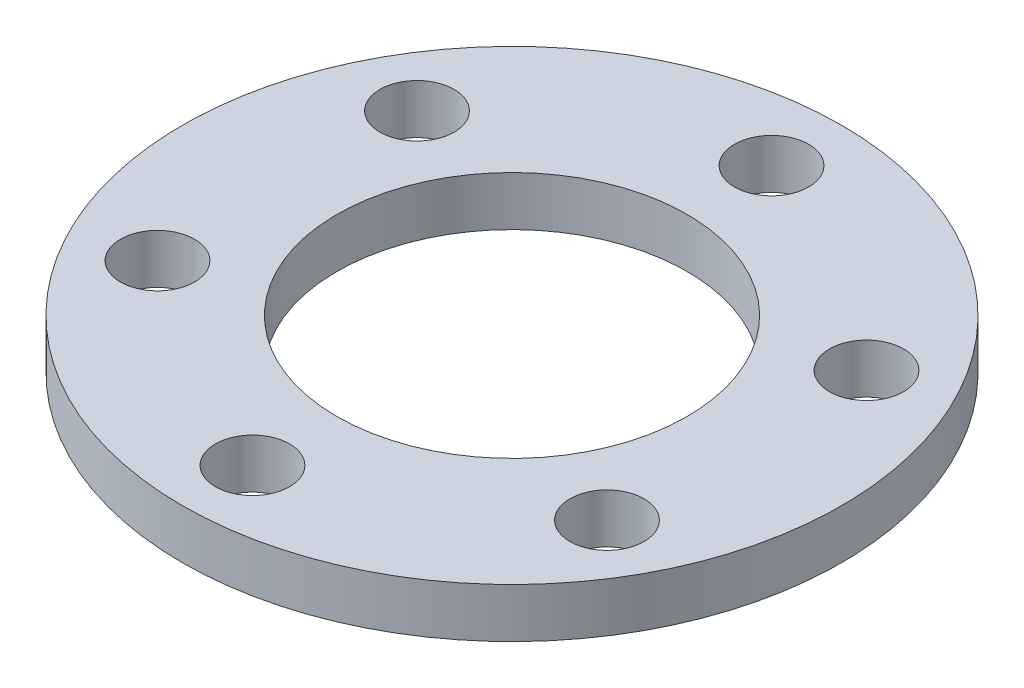
from build123d import *

# Parameters (mm, degrees)
SKETCH_1_R      = 40
SKETCH_1_R_2    = 21.25
SKETCH_1_R_3    = 4.5
EXTRUDE_1_DEPTH = 6


with BuildPart() as part:
    # 草图1 → 凸台-拉伸1 (new body)
    with BuildSketch(Plane(origin=(0, 0, 0), x_dir=(1, 0, 0), z_dir=(0, 1, 0))):
        with Locations(Location((0, 0, 0), (0, 0, 270))):
            Circle(SKETCH_1_R)
        with Locations(Location((0, 0, 0), (0, 0, 270))):
            Circle(SKETCH_1_R_2, mode=Mode.SUBTRACT)
        with Locations(Location((0, 31.5, 0), (0, 0, 270))):
            Circle(SKETCH_1_R_3, mode=Mode.SUBTRACT)
        with Locations(Location((27.279800219, 15.75, 0), (0, 0, 270))):
            Circle(SKETCH_1_R_3, mode=Mode.SUBTRACT)
        with Locations(Location((27.279800219, -15.75, 0), (0, 0, 270))):
            Circle(SKETCH_1_R_3, mode=Mode.SUBTRACT)
        with Locations(Location((0, -31.5, 0), (0, 0, 270))):
            Circle(SKETCH_1_R_3, mode=Mode.SUBTRACT)
        with Locations(Location((-27.279800219, -15.75, 0), (0, 0, 270))):
            Circle(SKETCH_1_R_3, mode=Mode.SUBTRACT)
        with Locations(Location((-27.279800219, 15.75, 0), (0, 0, 270))):
            Circle(SKETCH_1_R_3, mode=Mode.SUBTRACT)
    extrude(amount=EXTRUDE_1_DEPTH)


solid = part.part
